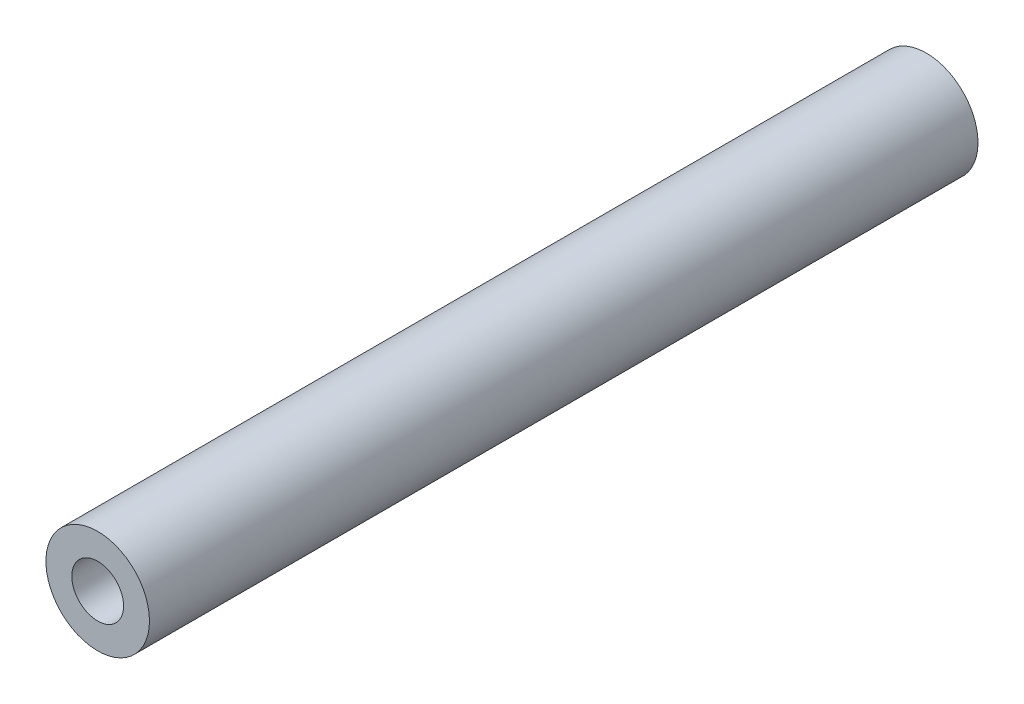
from build123d import *

# Parameters (mm, degrees)
SKETCH_1_R      = 4
SKETCH_1_R_2    = 2
EXTRUDE_1_DEPTH = 32


with BuildPart() as part:
    # 草图1 → 凸台-拉伸1 (new, symmetric)
    with BuildSketch(Plane.XY):
        Circle(SKETCH_1_R)
        Circle(SKETCH_1_R_2, mode=Mode.SUBTRACT)
    extrude(amount=EXTRUDE_1_DEPTH, both=True)


solid = part.part
